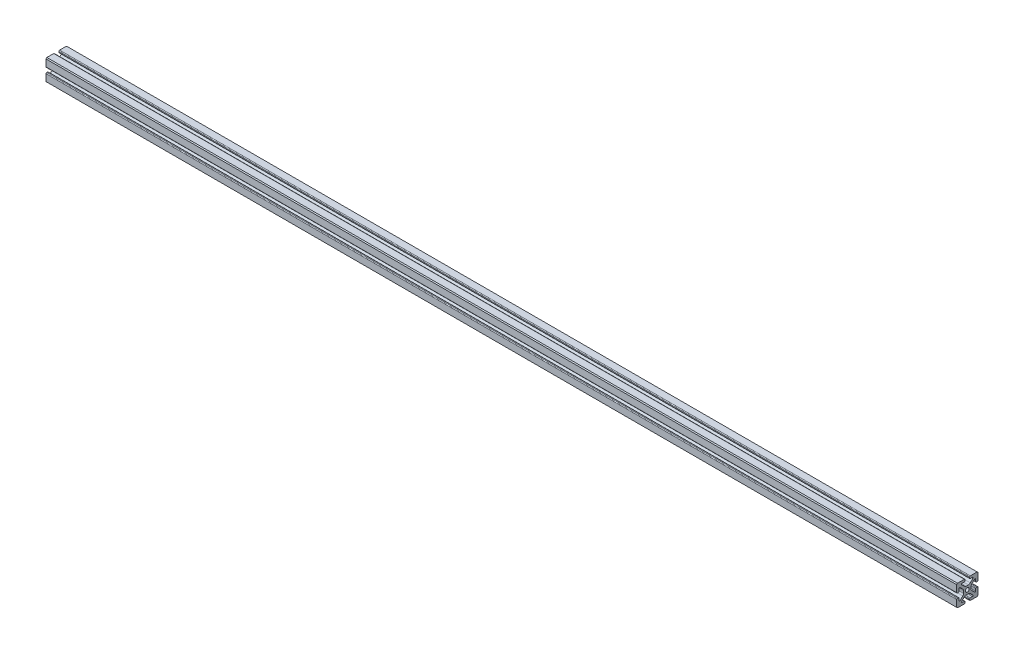
from build123d import *

# Parameters (mm, degrees)
SKETCH1_R           = 3.4036
BOSS_EXTRUDE1_DEPTH = 1625.6


with BuildPart() as part:
    # Sketch1 → Boss-Extrude1 (new body)
    with BuildSketch(Plane(origin=(0, 0, 0), x_dir=(0, -1, 0), z_dir=(-1, 0, 0))):
        with BuildLine():
            Line((19.05, 5.333992226), (19.05, 17.526))
            Line((19.05, 17.526), (17.526, 19.05))
            Line((17.526, 19.05), (5.333991729, 19.05))
            ThreePointArc((5.333991729, 19.05), (4.435966117, 18.678025612), (4.063991729, 17.78))
            Line((4.063991729, 17.78), (4.063991729, 16.12658277))
            ThreePointArc((4.063991729, 16.12658277), (4.435966117, 15.228557158), (5.333991729, 14.85658277))
            Line((5.333991729, 14.85658277), (9.096353874, 14.85658277))
            ThreePointArc((9.096353874, 14.85658277), (9.938252886, 14.507856781), (10.286978874, 13.66595777))
            Line((10.286978874, 13.66595777), (10.286978874, 13.653830065))
            ThreePointArc((10.286978874, 13.653830065), (10.196347959, 13.198197641), (9.938252944, 12.811931112))
            Line((9.938252944, 12.811931112), (5.277611896, 8.151289413))
            ThreePointArc((5.277611896, 8.151289413), (3.732545616, 7.118909013), (1.910015615, 6.756385223))
            Line((1.910015615, 6.756385223), (-1.910018596, 6.756385223))
            ThreePointArc((-1.910018596, 6.756385223), (-3.732548289, 7.118908885), (-5.277614406, 8.151288942))
            Line((-5.277614406, 8.151288942), (-9.93825393, 12.811927815))
            ThreePointArc((-9.93825393, 12.811927815), (-10.19634903, 13.198194385), (-10.286979978, 13.653826886))
            Line((-10.286979978, 13.653826886), (-10.286979978, 13.66595777))
            ThreePointArc((-10.286979978, 13.66595777), (-9.938253989, 14.507856781), (-9.096354978, 14.85658277))
            Line((-9.096354978, 14.85658277), (-5.333992226, 14.85658277))
            ThreePointArc((-5.333992226, 14.85658277), (-4.435966614, 15.228557158), (-4.063992226, 16.12658277))
            Line((-4.063992226, 16.12658277), (-4.063992226, 17.78))
            ThreePointArc((-4.063992226, 17.78), (-4.435966614, 18.678025612), (-5.333992226, 19.05))
            Line((-5.333992226, 19.05), (-17.526, 19.05))
            Line((-17.526, 19.05), (-19.05, 17.526))
            Line((-19.05, 17.526), (-19.05, 5.333992226))
            ThreePointArc((-19.05, 5.333992226), (-18.678025612, 4.435966614), (-17.78, 4.063992226))
            Line((-17.78, 4.063992226), (-16.12658277, 4.063992226))
            ThreePointArc((-16.12658277, 4.063992226), (-15.228557158, 4.435966614), (-14.85658277, 5.333992226))
            Line((-14.85658277, 5.333992226), (-14.85658277, 9.096354978))
            ThreePointArc((-14.85658277, 9.096354978), (-14.507856781, 9.938253989), (-13.66595777, 10.286979978))
            Line((-13.66595777, 10.286979978), (-13.653827218, 10.286979978))
            ThreePointArc((-13.653827218, 10.286979978), (-13.198194795, 10.196349062), (-12.811928266, 9.938254048))
            Line((-12.811928266, 9.938254048), (-8.151289413, 5.277615846))
            ThreePointArc((-8.151289413, 5.277615846), (-7.118909013, 3.732549566), (-6.756385223, 1.910019566))
            Line((-6.756385223, 1.910019566), (-6.756385223, -1.910017492))
            ThreePointArc((-6.756385223, -1.910017492), (-7.118908885, -3.732547185), (-8.151288942, -5.277613302))
            Line((-8.151288942, -5.277613302), (-12.811927815, -9.938252827))
            ThreePointArc((-12.811927815, -9.938252827), (-13.198194385, -10.196347927), (-13.653826886, -10.286978874))
            Line((-13.653826886, -10.286978874), (-13.66595777, -10.286978874))
            ThreePointArc((-13.66595777, -10.286978874), (-14.507856781, -9.938252886), (-14.85658277, -9.096353874))
            Line((-14.85658277, -9.096353874), (-14.85658277, -5.333991729))
            ThreePointArc((-14.85658277, -5.333991729), (-15.228557158, -4.435966117), (-16.12658277, -4.063991729))
            Line((-16.12658277, -4.063991729), (-17.78, -4.063991729))
            ThreePointArc((-17.78, -4.063991729), (-18.678025612, -4.435966117), (-19.05, -5.333991729))
            Line((-19.05, -5.333991729), (-19.05, -17.526))
            Line((-19.05, -17.526), (-17.526, -19.05))
            Line((-17.526, -19.05), (-5.333992226, -19.05))
            ThreePointArc((-5.333992226, -19.05), (-4.435966614, -18.678025612), (-4.063992226, -17.78))
            Line((-4.063992226, -17.78), (-4.063992226, -16.126583724))
            ThreePointArc((-4.063992226, -16.126583724), (-4.435966614, -15.228558112), (-5.333992226, -14.856583724))
            Line((-5.333992226, -14.856583724), (-9.096354978, -14.856583724))
            ThreePointArc((-9.096354978, -14.856583724), (-9.938253989, -14.507857736), (-10.286979978, -13.665958724))
            Line((-10.286979978, -13.665958724), (-10.286979978, -13.653828173))
            ThreePointArc((-10.286979978, -13.653828173), (-10.196349062, -13.198195749), (-9.938254048, -12.81192922))
            Line((-9.938254048, -12.81192922), (-5.277615159, -8.15128968))
            ThreePointArc((-5.277615159, -8.15128968), (-3.732548878, -7.11890928), (-1.910018878, -6.75638549))
            Line((-1.910018878, -6.75638549), (1.910021709, -6.75638549))
            ThreePointArc((1.910021709, -6.75638549), (3.732551402, -7.118909152), (5.277617519, -8.151289209))
            Line((5.277617519, -8.151289209), (9.938252827, -12.811923865))
            ThreePointArc((9.938252827, -12.811923865), (10.196347927, -13.198190435), (10.286978874, -13.653822935))
            Line((10.286978874, -13.653822935), (10.286978874, -13.665958724))
            ThreePointArc((10.286978874, -13.665958724), (9.938252886, -14.507857736), (9.096353874, -14.856583724))
            Line((9.096353874, -14.856583724), (5.333991729, -14.856583724))
            ThreePointArc((5.333991729, -14.856583724), (4.435966117, -15.228558112), (4.063991729, -16.126583724))
            Line((4.063991729, -16.126583724), (4.063991729, -17.78))
            ThreePointArc((4.063991729, -17.78), (4.435966117, -18.678025612), (5.333991729, -19.05))
            Line((5.333991729, -19.05), (17.526, -19.05))
            Line((17.526, -19.05), (19.05, -17.526))
            Line((19.05, -17.526), (19.05, -5.333991729))
            ThreePointArc((19.05, -5.333991729), (18.678025612, -4.435966117), (17.78, -4.063991729))
            Line((17.78, -4.063991729), (16.126583724, -4.063991729))
            ThreePointArc((16.126583724, -4.063991729), (15.228558112, -4.435966117), (14.856583724, -5.333991729))
            Line((14.856583724, -5.333991729), (14.856583724, -9.096353874))
            ThreePointArc((14.856583724, -9.096353874), (14.507857736, -9.938252886), (13.665958724, -10.286978874))
            Line((13.665958724, -10.286978874), (13.653828961, -10.286978874))
            ThreePointArc((13.653828961, -10.286978874), (13.198196538, -10.196347959), (12.811930009, -9.938252944))
            Line((12.811930009, -9.938252944), (8.151290074, -5.277613661))
            ThreePointArc((8.151290074, -5.277613661), (7.118909674, -3.732547381), (6.756385884, -1.91001738))
            Line((6.756385884, -1.91001738), (6.756385884, 1.910021149))
            ThreePointArc((6.756385884, 1.910021149), (7.118909547, 3.732550842), (8.151289603, 5.277616959))
            Line((8.151289603, 5.277616959), (12.811925923, 9.93825393))
            ThreePointArc((12.811925923, 9.93825393), (13.198192493, 10.19634903), (13.653824993, 10.286979978))
            Line((13.653824993, 10.286979978), (13.665958724, 10.286979978))
            ThreePointArc((13.665958724, 10.286979978), (14.507857736, 9.938253989), (14.856583724, 9.096354978))
            Line((14.856583724, 9.096354978), (14.856583724, 5.333992226))
            ThreePointArc((14.856583724, 5.333992226), (15.228558112, 4.435966614), (16.126583724, 4.063992226))
            Line((16.126583724, 4.063992226), (17.78, 4.063992226))
            ThreePointArc((17.78, 4.063992226), (18.678025612, 4.435966614), (19.05, 5.333992226))
        make_face()
        with Locations(Location((0, 0, 0), (0, 0, 270))):
            Circle(SKETCH1_R, mode=Mode.SUBTRACT)
    extrude(amount=-BOSS_EXTRUDE1_DEPTH)


solid = part.part
